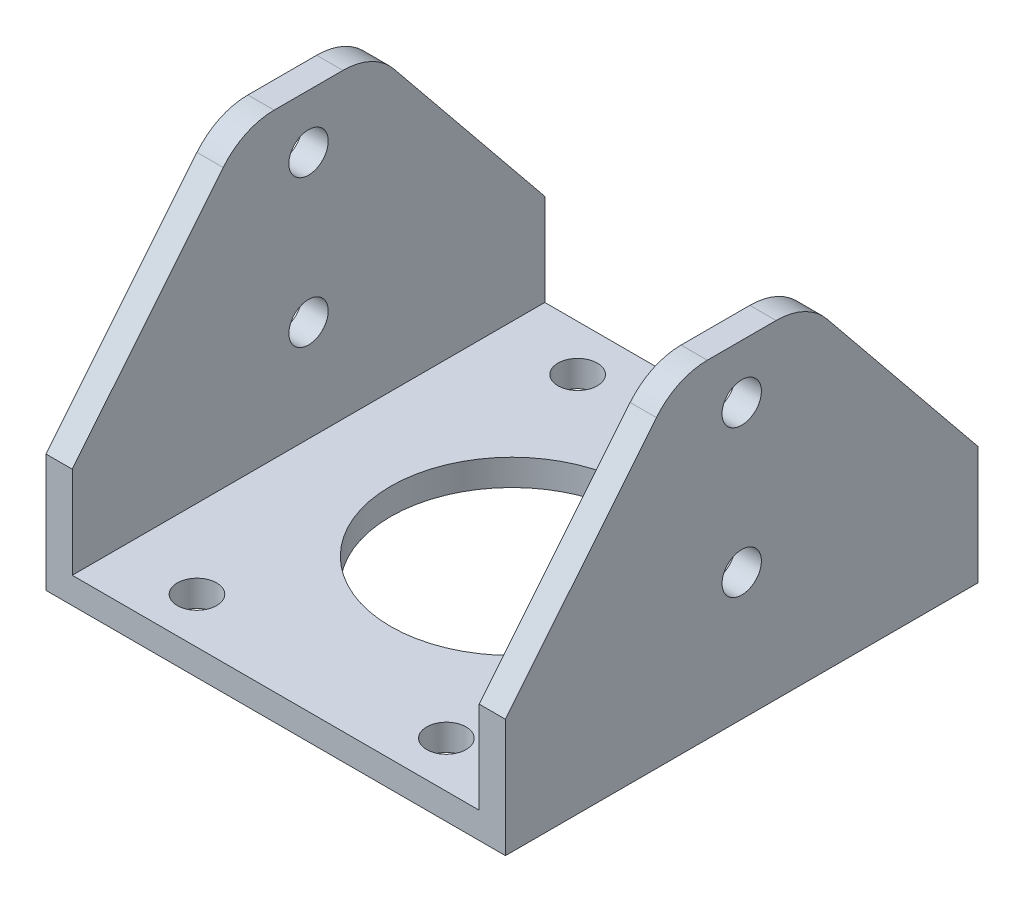
from build123d import *

# Parameters (mm, degrees)
EXTRUDE_1_DEPTH     = 36
SKETCH_2_R          = 9.25
CUT_EXTRUDE_1_DEPTH = 12
SKETCH_3_R          = 1.5
CUT_EXTRUDE_2_DEPTH = 54
SKETCH_5_R          = 1.5
CUT_EXTRUDE_4_DEPTH = 10
CUT_EXTRUDE_5_DEPTH = 57
FILLET_1_R          = 5


with BuildPart() as part:
    # 草图1 → 凸台-拉伸1 (new body)
    with BuildSketch(Plane.XY):
        Polygon((0, 0), (0, 25), (2, 25), (2, 2), (33, 2), (33, 25), (35, 25), (35, 0), align=None)
    extrude(amount=EXTRUDE_1_DEPTH)

    # 草图2 → 切除-拉伸1 (cut)
    with BuildSketch(Plane.XZ):
        with Locations(Location((17.5, 18, 0), (0, 0, 270))):
            Circle(SKETCH_2_R)
    extrude(amount=-CUT_EXTRUDE_1_DEPTH, mode=Mode.SUBTRACT)

    # 草图3 → 切除-拉伸2 (cut)
    with BuildSketch(Plane.ZY):
        with Locations((18, 20.9)):
            Circle(SKETCH_3_R)
        with Locations((18, 9.7)):
            Circle(SKETCH_3_R)
    extrude(amount=-CUT_EXTRUDE_2_DEPTH, mode=Mode.SUBTRACT)

    # 草图5 → 切除-拉伸4 (cut)
    with BuildSketch(Plane(origin=(0, 2, 0), x_dir=(1, 0, 0), z_dir=(0, 1, 0))):
        with Locations(Location((8, -3.5, 0), (0, 0, 180))):
            Circle(SKETCH_5_R)
        with Locations(Location((27, -3.5, 0), (0, 0, 180))):
            Circle(SKETCH_5_R)
        with Locations(Location((8, -32.5, 0), (0, 0, 180))):
            Circle(SKETCH_5_R)
        with Locations(Location((27, -32.5, 0), (0, 0, 180))):
            Circle(SKETCH_5_R)
    extrude(amount=-CUT_EXTRUDE_4_DEPTH, mode=Mode.SUBTRACT)

    # 草图6 → 切除-拉伸5 (cut)
    with BuildSketch(Plane.ZY):
        Polygon((0, 9), (13, 25), (0, 25), align=None)
        Polygon((36, 25), (36, 9), (23, 25), align=None)
    extrude(amount=-CUT_EXTRUDE_5_DEPTH, mode=Mode.SUBTRACT)

    # 圆角1
    fillet_1_edges = [part.edges().sort_by_distance(p)[0] for p in [
        (34, 25, 13),
        (1, 25, 13),
        (34, 25, 23),
        (1, 25, 23),
    ]]
    fillet(fillet_1_edges, radius=FILLET_1_R)


solid = part.part
